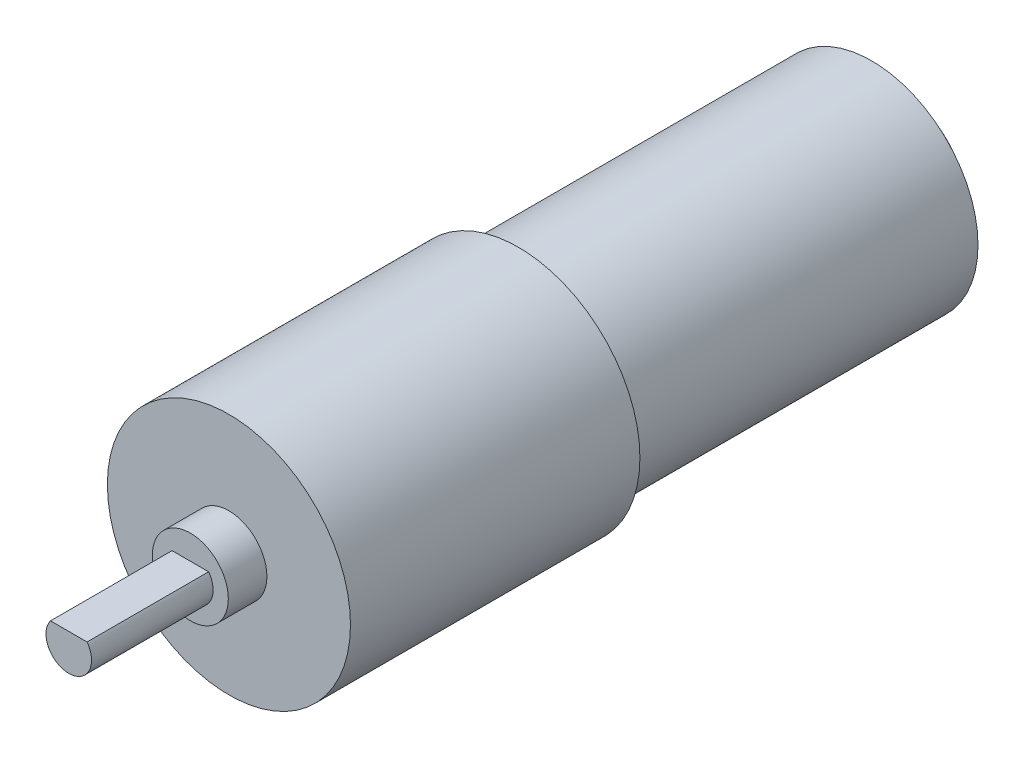
from build123d import *

# Parameters (mm, degrees)
SKETCH2_R           = 8
BASE_EXTRUDE_DEPTH  = 19.05
SKETCH3_R           = 2.5
BOSS_EXTRUDE1_DEPTH = 2.54
SKETCH5_R           = 1.5
BOSS_EXTRUDE2_DEPTH = 8
CUT_EXTRUDE1_START  = -8
CUT_EXTRUDE1_DEPTH  = 8
SKETCH7_R           = 7
BOSS_EXTRUDE3_DEPTH = 23.25
BOSS_EXTRUDE4_DEPTH = 2


with BuildPart() as part:
    # Sketch2 → Base-Extrude (new body)
    with BuildSketch(Plane.XY):
        Circle(SKETCH2_R)
    extrude(amount=-BASE_EXTRUDE_DEPTH)

    # Sketch3 → Boss-Extrude1 (add)
    with BuildSketch(Plane.XY):
        Circle(SKETCH3_R)
    extrude(amount=BOSS_EXTRUDE1_DEPTH)

    # Sketch5 → Boss-Extrude2 (add)
    with BuildSketch(Plane.XY.offset(2.54)):
        Circle(SKETCH5_R)
    extrude(amount=BOSS_EXTRUDE2_DEPTH)

    # Sketch6 → Cut-Extrude1 (cut)
    with BuildSketch(Plane.XY.offset(10.54).offset(CUT_EXTRUDE1_START)):
        with BuildLine():
            Line((-2.334314707, 0.894971982), (2.334314707, 0.894971982))
            ThreePointArc((2.334314707, 0.894971982), (0, 2.5), (-2.334314707, 0.894971982))
        make_face()
    extrude(amount=CUT_EXTRUDE1_DEPTH, mode=Mode.SUBTRACT)

    # Sketch7 → Boss-Extrude3 (add)
    with BuildSketch(Plane(origin=(0, 0, -19.05), x_dir=(-1, 0, 0), z_dir=(0, 0, -1))):
        with Locations(Location((0, 0, 0), (0, 0, 180))):
            Circle(SKETCH7_R)
    extrude(amount=BOSS_EXTRUDE3_DEPTH)

    # Sketch8 → Boss-Extrude4 (add)
    with BuildSketch(Plane(origin=(0, 0, -42.3), x_dir=(-1, 0, 0), z_dir=(0, 0, -1))):
        with BuildLine():
            Line((3.2, 2.704829015), (3.2, -2.704829015))
            ThreePointArc((3.2, -2.704829015), (-4.19, 0), (3.2, 2.704829015))
        make_face()
    extrude(amount=BOSS_EXTRUDE4_DEPTH)


solid = part.part
